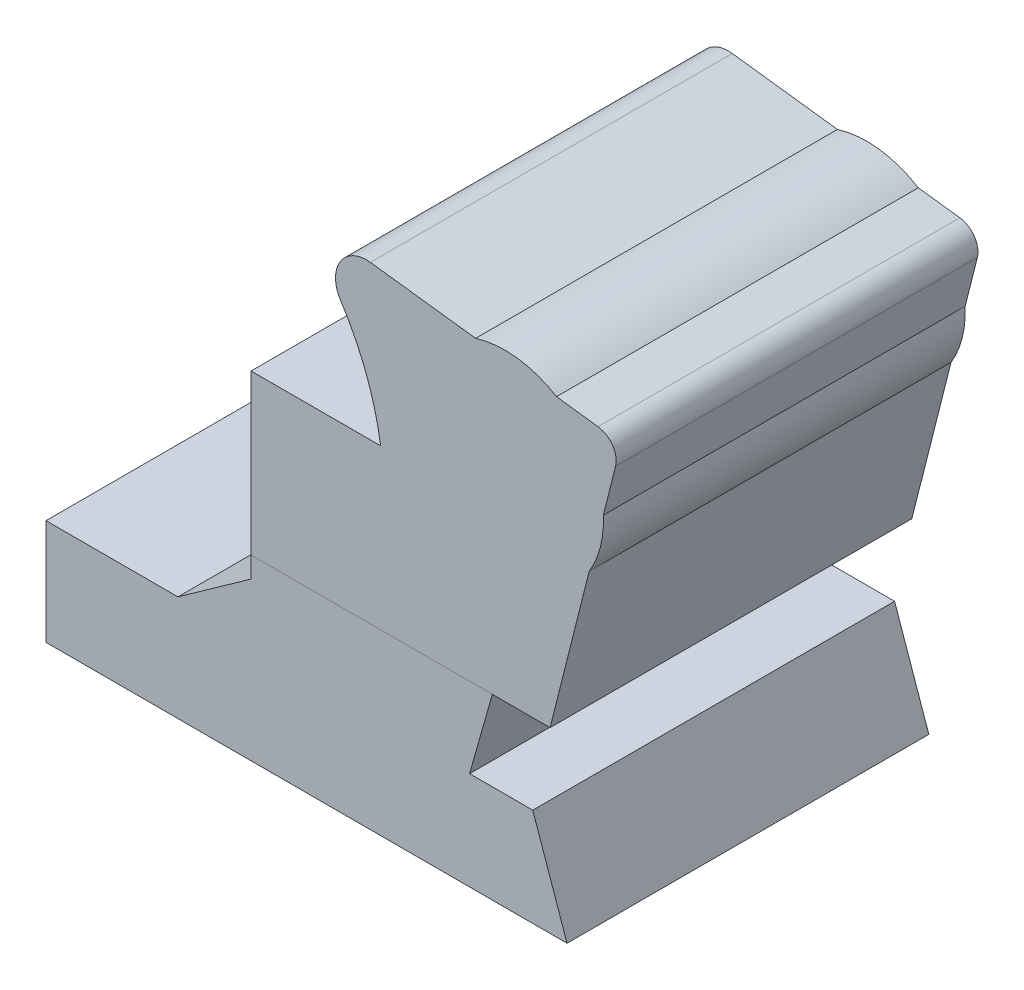
from build123d import *

# Parameters (mm, degrees)
SKETCH_1_R                     = 27.218239916
EXTRUDE_1_DEPTH                = 50
SPLIT_BODIES_1_SURFACE_1_BACK  = 231.852
SPLIT_BODIES_1_SURFACE_1_DEPTH = 463.704
SPLIT_BODIES_1_SURFACE_2_BACK  = 231.852
SPLIT_BODIES_1_SURFACE_2_DEPTH = 463.704


with BuildPart() as part:
    # 草图1 → 凸台-拉伸1 (new, symmetric)
    with BuildSketch(Plane.XY):
        with Locations((126.841, 106.1775)):
            Circle(SKETCH_1_R)
        with BuildLine():
            Line((36.476006197, 29.147891414), (56.67204093, 43.504108875))
            Line((56.67204093, 43.504108875), (56.67204093, 93.307484045))
            Line((56.67204093, 93.307484045), (92.496172884, 93.307484045))
            ThreePointArc((92.496172884, 93.307484045), (88.507151815, 108.556758389), (81.393508143, 122.622629526))
            ThreePointArc((81.393508143, 122.622629526), (81.328816917, 131.844883349), (89.661, 135.798220622))
            Line((89.661, 135.798220622), (152.57565846, 127.931864381))
            ThreePointArc((152.57565846, 127.931864381), (156.589044848, 125.482703859), (157.411382406, 120.853511867))
            Line((157.411382406, 120.853511867), (139.303205185, 49.257428232))
            Line((139.303205185, 49.257428232), (123.353516134, 49.257428232))
            Line((123.353516134, 49.257428232), (117.072161438, 27.122156161))
            Line((117.072161438, 27.122156161), (134.529857437, 27.122156161))
            Line((134.529857437, 27.122156161), (144.001, 0))
            Line((144.001, 0), (0, 0))
            Line((0, 0), (0, 29.147891414))
            Line((0, 29.147891414), (36.476006197, 29.147891414))
        make_face()
    extrude(amount=EXTRUDE_1_DEPTH, both=True)


with BuildPart() as body_2:
    # Split Bodies 1: the piece behind the surface
    add(part.part)
    # Split Bodies 1 surface: a surface, the sketch's curves swept straight by 463.704 mm
    with BuildLine(Plane.XY.offset(50).offset(-SPLIT_BODIES_1_SURFACE_1_BACK), mode=Mode.PRIVATE) as split_bodies_1_surface_1_path:
        Line((123.353516134, 49.257428232), (56.67204093, 49.257428232))
    split_bodies_1_surface_1 = Shell.extrude(split_bodies_1_surface_1_path.wire(), (0 * SPLIT_BODIES_1_SURFACE_1_DEPTH, 0 * SPLIT_BODIES_1_SURFACE_1_DEPTH, 1 * SPLIT_BODIES_1_SURFACE_1_DEPTH))
    split(bisect_by=split_bodies_1_surface_1, keep=Keep.BOTTOM)


with BuildPart() as part_1:
    add(part.part)

    # Split Bodies 1: split by a surface, the side it looks to stays
    # Split Bodies 1 surface: a surface, the sketch's curves swept straight by 463.704 mm
    with BuildLine(Plane.XY.offset(50).offset(-SPLIT_BODIES_1_SURFACE_2_BACK), mode=Mode.PRIVATE) as split_bodies_1_surface_2_path:
        Line((123.353516134, 49.257428232), (56.67204093, 49.257428232))
    split_bodies_1_surface_2 = Shell.extrude(split_bodies_1_surface_2_path.wire(), (0 * SPLIT_BODIES_1_SURFACE_2_DEPTH, 0 * SPLIT_BODIES_1_SURFACE_2_DEPTH, 1 * SPLIT_BODIES_1_SURFACE_2_DEPTH))
    split(bisect_by=split_bodies_1_surface_2, keep=Keep.TOP)


solid = Compound([body_2.part, part_1.part])
